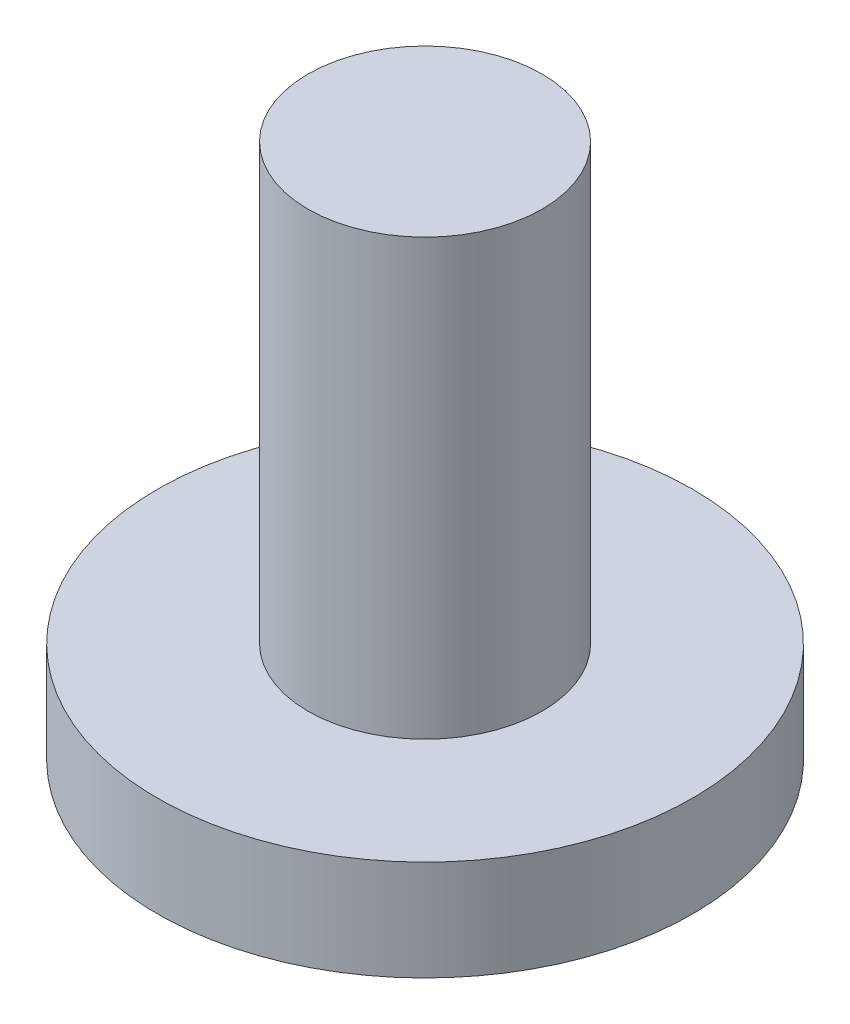
from build123d import *

# Parameters (mm, degrees)
SKETCH1_R           = 1.75
BOSS_EXTRUDE1_DEPTH = 8
SKETCH2_R           = 4
BOSS_EXTRUDE2_DEPTH = 1.5


with BuildPart() as part:
    # Sketch1 → Boss-Extrude1 (new body)
    with BuildSketch(Plane(origin=(0, 0, 0), x_dir=(1, 0, 0), z_dir=(0, 1, 0))):
        with Locations(Location((0, 0, 0), (0, 0, 270))):
            Circle(SKETCH1_R)
    extrude(amount=BOSS_EXTRUDE1_DEPTH)

    # Sketch2 → Boss-Extrude2 (add)
    with BuildSketch(Plane.XZ):
        with Locations(Location((0, 0, 0), (0, 0, 270))):
            Circle(SKETCH2_R)
    extrude(amount=-BOSS_EXTRUDE2_DEPTH)


solid = part.part
